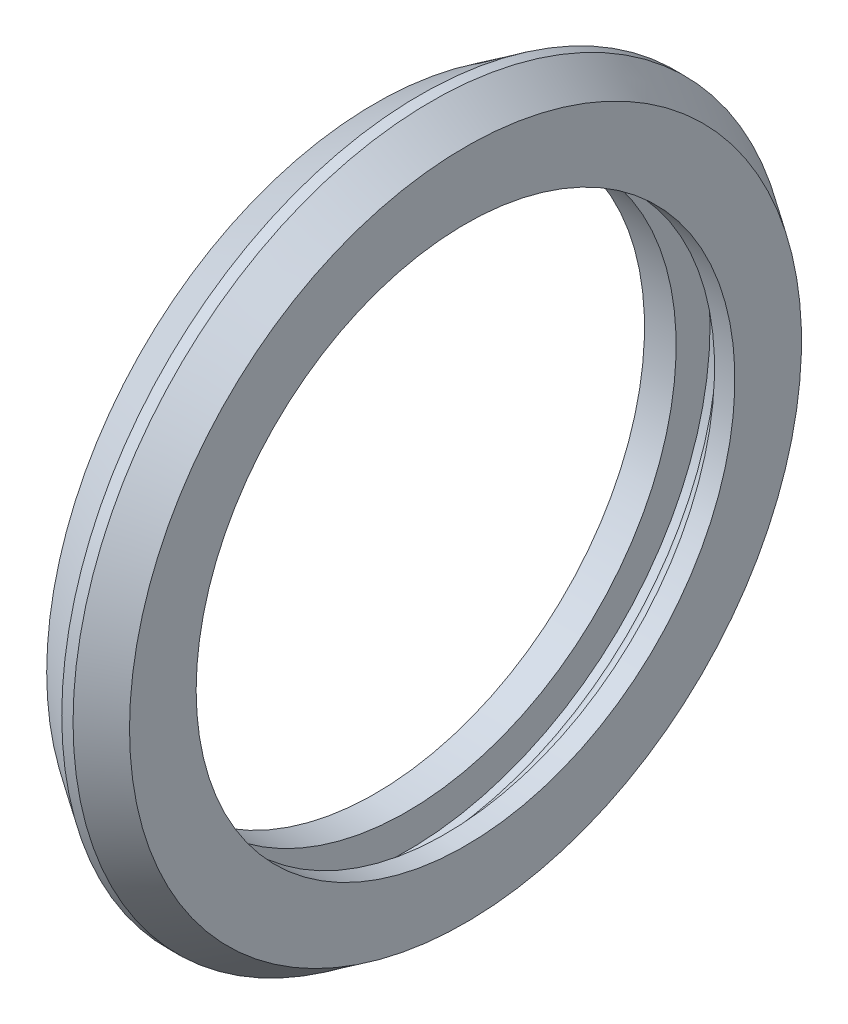
from build123d import *

# Parameters (mm, degrees)
SKETCH_1_R = 0.75
SKETCH_1_W = 1.8
SKETCH_1_H = 3


with BuildPart() as part:
    # Эскиз1 → Повернуть1 (revolve)
    with BuildSketch(Plane(origin=(0, 0, 0), x_dir=(1, 0, 0), z_dir=(0, 1, 0)), mode=Mode.PRIVATE) as revolve_1_sk:
        with Locations((0, 26.85)):
            Circle(SKETCH_1_R)
        Polygon((-3.5, 26.85), (3.5, 26.85), (3.5, 29.75), (0.5, 31.75), (-0.5, 31.75), (-3.5, 29.75), align=None)
        with BuildLine():
            Line((-0.75, 26.85), (0, 26.85))
            Line((0, 26.85), (0.75, 26.85))
            ThreePointArc((0.75, 26.85), (0, 27.6), (-0.75, 26.85))
        make_face()
        with BuildLine():
            ThreePointArc((-0.75, 26.85), (-0.530330086, 26.319669914), (0, 26.1))
            Line((0, 26.1), (0, 26.85))
            Line((0, 26.85), (-0.75, 26.85))
        make_face()
        with BuildLine():
            Line((0, 26.85), (0, 26.1))
            ThreePointArc((0, 26.1), (0.530330086, 26.319669914), (0.75, 26.85))
            Line((0.75, 26.85), (0, 26.85))
        make_face()
        Polygon((-4.5, 29.083333333), (-4.5, 23.85), (-3.5, 23.85), (-3.5, 26.85), (-3.5, 29.75), align=None)
        with Locations((-2.6, 25.35)):
            Rectangle(SKETCH_1_W, SKETCH_1_H)
        with Locations((2.6, 25.35)):
            Rectangle(SKETCH_1_W, SKETCH_1_H)
    revolve(revolve_1_sk.sketch.rotate(Axis((0, 0, 0), (1, 0, 0)), 180), axis=Axis((0, 0, 0), (1, 0, 0)))


solid = part.part
